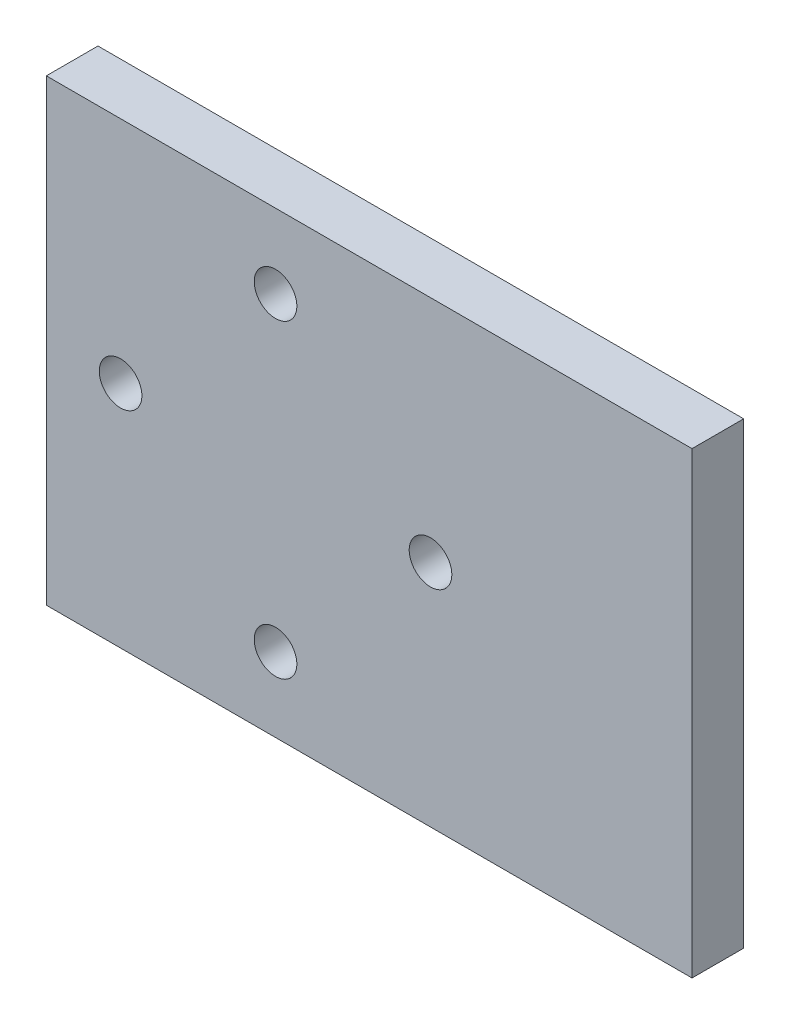
from build123d import *

# Parameters (mm, degrees)
SKETCH_1_W            = 100
SKETCH_1_H            = 71
EXTRUDE_1_DEPTH       = 8
HOLE_WIZARD_G1_16_1_D = 6.6


with BuildPart() as part:
    # 스케치1 → 보스-돌출1 (new body)
    with BuildSketch(Plane.XY):
        Rectangle(SKETCH_1_W, SKETCH_1_H)
    extrude(amount=EXTRUDE_1_DEPTH)

    # G1/16 나사 구멍1 (through all)
    with Locations(Plane(origin=(-38.5, 0, 8), x_dir=(1, 0, 0), z_dir=(0, 0, 1))):
        with Locations((0, 0), (24, -24), (48, 0), (24, 24)):
            Hole(HOLE_WIZARD_G1_16_1_D / 2)


solid = part.part
